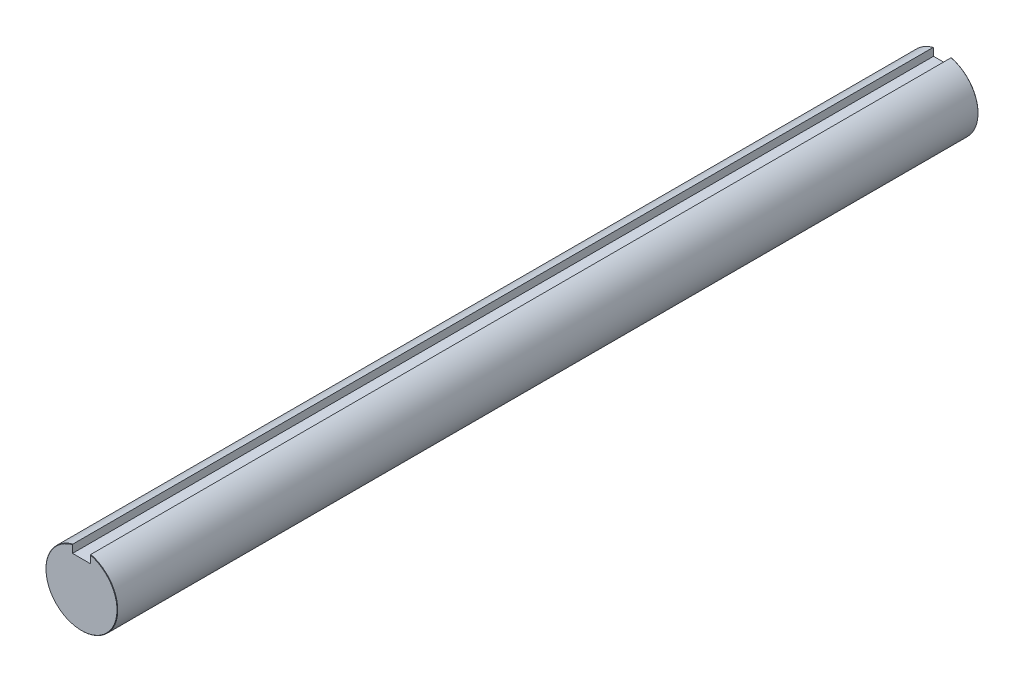
from build123d import *

# Parameters (mm, degrees)
BOSS_EXTRUDE1_DEPTH      = 76.2
BOSS_EXTRUDE1_DEPTH_BACK = 76.2
CHAMFER1_SIZE            = 0.0635


with BuildPart() as part:
    # Sketch3 → Boss-Extrude1 (new, two sides: drawn at the far end of the back side and taken through both)
    with BuildSketch(Plane.XY.offset(-BOSS_EXTRUDE1_DEPTH_BACK)):
        with BuildLine():
            Line((-1.5875, 4.7498), (-1.5875, 6.148361062))
            ThreePointArc((-1.5875, 6.148361062), (0, -6.35), (1.5875, 6.148361062))
            Line((1.5875, 6.148361062), (1.5875, 4.7498))
            Line((1.5875, 4.7498), (-1.5875, 4.7498))
        make_face()
    extrude(amount=BOSS_EXTRUDE1_DEPTH + BOSS_EXTRUDE1_DEPTH_BACK)

    # Chamfer1
    chamfer1_edges = [part.edges().sort_by_distance(p)[0] for p in [
        (0, -6.35, -76.2),
        (0, -6.35, 76.2),
    ]]
    chamfer(chamfer1_edges, length=CHAMFER1_SIZE)


solid = part.part
